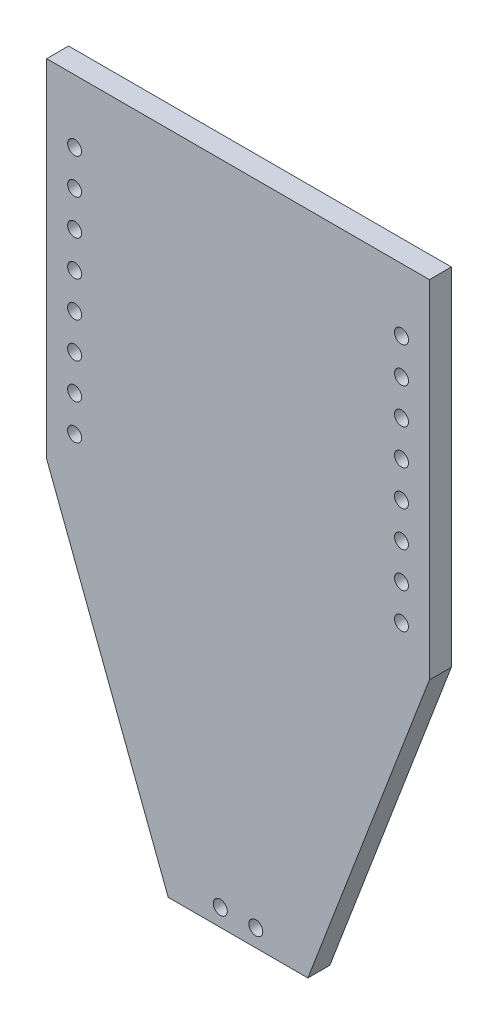
from build123d import *

# Parameters (mm, degrees)
SKETCH1_R           = 0.5
BOSS_EXTRUDE1_DEPTH = 1.57


with BuildPart() as part:
    # Sketch1 → Boss-Extrude1 (new body)
    with BuildSketch(Plane.XY):
        Polygon((13.7, 19.85), (-13.7, 19.85), (-13.7, -4.97), (-5, -27.8), (5, -27.8), (13.7, -4.97), align=None)
        with Locations((11.7, -2.43)):
            Circle(SKETCH1_R, mode=Mode.SUBTRACT)
        with Locations((11.7, 0.11)):
            Circle(SKETCH1_R, mode=Mode.SUBTRACT)
        with Locations((11.7, 2.65)):
            Circle(SKETCH1_R, mode=Mode.SUBTRACT)
        with Locations((11.7, 5.19)):
            Circle(SKETCH1_R, mode=Mode.SUBTRACT)
        with Locations((11.7, 7.73)):
            Circle(SKETCH1_R, mode=Mode.SUBTRACT)
        with Locations((11.7, 10.27)):
            Circle(SKETCH1_R, mode=Mode.SUBTRACT)
        with Locations((11.7, 12.81)):
            Circle(SKETCH1_R, mode=Mode.SUBTRACT)
        with Locations((11.7, 15.35)):
            Circle(SKETCH1_R, mode=Mode.SUBTRACT)
        with Locations((-11.7, 15.35)):
            Circle(SKETCH1_R, mode=Mode.SUBTRACT)
        with Locations((-11.7, -2.43)):
            Circle(SKETCH1_R, mode=Mode.SUBTRACT)
        with Locations((-11.7, 0.11)):
            Circle(SKETCH1_R, mode=Mode.SUBTRACT)
        with Locations((-11.7, 2.65)):
            Circle(SKETCH1_R, mode=Mode.SUBTRACT)
        with Locations((-11.7, 5.19)):
            Circle(SKETCH1_R, mode=Mode.SUBTRACT)
        with Locations((-11.7, 7.73)):
            Circle(SKETCH1_R, mode=Mode.SUBTRACT)
        with Locations((-11.7, 10.27)):
            Circle(SKETCH1_R, mode=Mode.SUBTRACT)
        with Locations((-11.7, 12.81)):
            Circle(SKETCH1_R, mode=Mode.SUBTRACT)
        with Locations((-1.27, -26.55)):
            Circle(SKETCH1_R, mode=Mode.SUBTRACT)
        with Locations((1.27, -26.55)):
            Circle(SKETCH1_R, mode=Mode.SUBTRACT)
    extrude(amount=BOSS_EXTRUDE1_DEPTH)


solid = part.part
